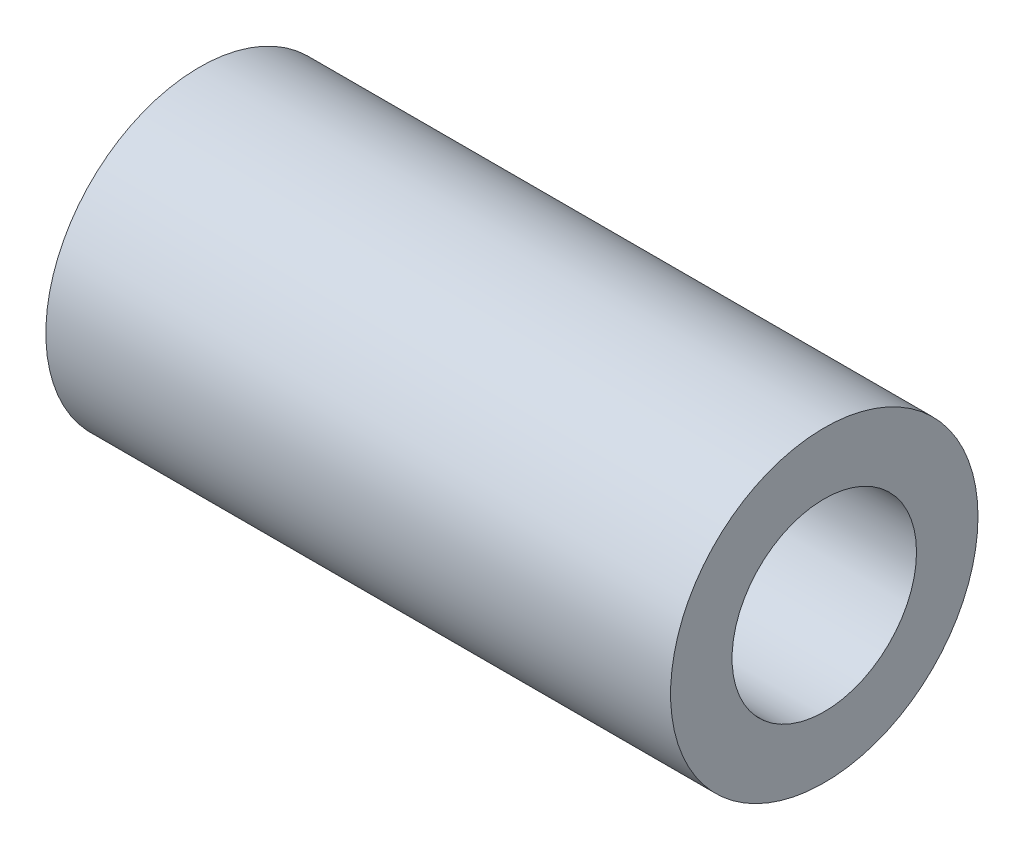
from build123d import *

# Parameters (mm, degrees)
SKETCH1_R           = 7.9375
SKETCH1_R_2         = 4.7625
BOSS_EXTRUDE1_DEPTH = 16.129


with BuildPart() as part:
    # Sketch1 → Boss-Extrude1 (new, symmetric)
    with BuildSketch(Plane(origin=(0, 0, 0), x_dir=(0, 0, -1), z_dir=(1, 0, 0))):
        Circle(SKETCH1_R)
        Circle(SKETCH1_R_2, mode=Mode.SUBTRACT)
    extrude(amount=BOSS_EXTRUDE1_DEPTH, both=True)


solid = part.part
